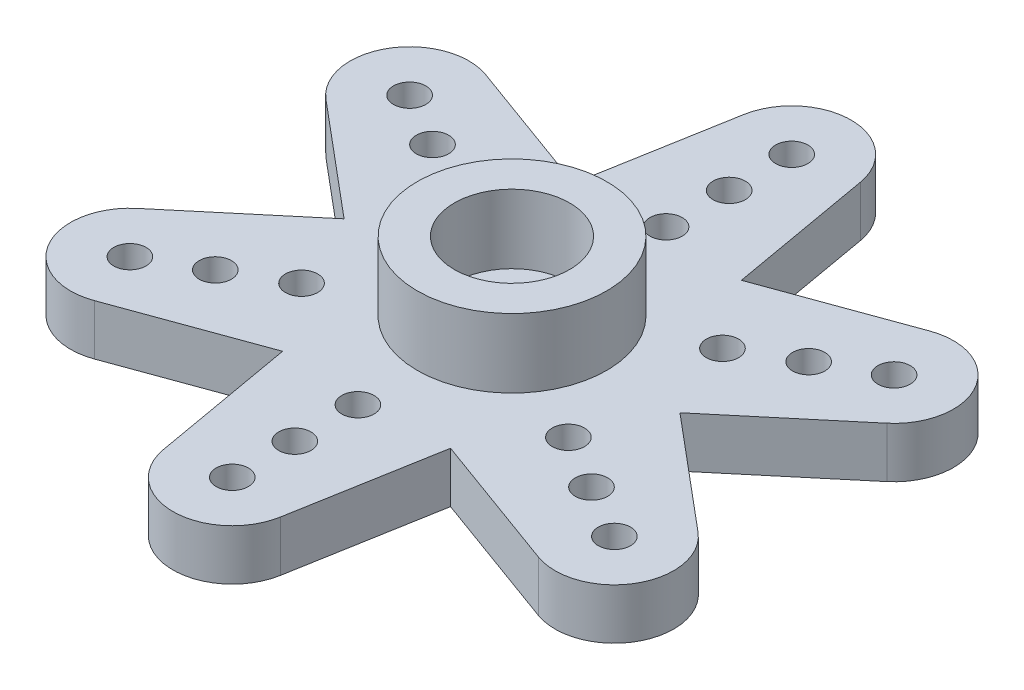
from build123d import *

# Parameters (mm, degrees)
SKETCH1_R           = 15.75
BOSS_EXTRUDE1_DEPTH = 2.35
CUT_EXTRUDE2_START  = -2.35
CUT_EXTRUDE2_DEPTH  = 2.35
SKETCH3_R           = 4.4
SKETCH3_R_2         = 2.68
BOSS_EXTRUDE2_DEPTH = 3.2
SKETCH4_R           = 1.5
CUT_EXTRUDE3_DEPTH  = 22.320518549


with BuildPart() as part:
    # Sketch1 → Boss-Extrude1 (new body)
    with BuildSketch(Plane(origin=(0, 0, 0), x_dir=(1, 0, 0), z_dir=(0, 1, 0))):
        with Locations(Location((0, 0, 0), (0, 0, 270))):
            Circle(SKETCH1_R)
    extrude(amount=BOSS_EXTRUDE1_DEPTH)

    # Sketch2 → Cut-Extrude2 (cut)
    with BuildSketch(Plane(origin=(0, 2.35, 0), x_dir=(1, 0, 0), z_dir=(0, 1, 0)).offset(CUT_EXTRUDE2_START)):
        with BuildLine():
            ThreePointArc((-11.901228971, -6.87117775), (-11.626709919, -5.846658698), (-10.602190866, -6.12117775))
            ThreePointArc((-10.602190866, -6.12117775), (-10.876709919, -7.145696803), (-11.901228971, -6.87117775))
        make_face()
        with BuildLine():
            ThreePointArc((-9.385628943, -5.418795397), (-9.11110989, -4.394276344), (-8.086590837, -4.668795397))
            ThreePointArc((-8.086590837, -4.668795397), (-8.36110989, -5.693314449), (-9.385628943, -5.418795397))
        make_face()
        with BuildLine():
            ThreePointArc((-6.846872878, -3.953043899), (-6.572353825, -2.928524846), (-5.547834772, -3.203043899))
            ThreePointArc((-5.547834772, -3.203043899), (-5.822353825, -4.227562952), (-6.846872878, -3.953043899))
        make_face()
        with BuildLine():
            ThreePointArc((-11.901228971, 6.87117775), (-10.876709919, 7.145696803), (-10.602190866, 6.12117775))
            ThreePointArc((-10.602190866, 6.12117775), (-11.626709919, 5.846658698), (-11.901228971, 6.87117775))
        make_face()
        with BuildLine():
            ThreePointArc((-9.385628943, 5.418795397), (-8.36110989, 5.693314449), (-8.086590837, 4.668795397))
            ThreePointArc((-8.086590837, 4.668795397), (-9.11110989, 4.394276344), (-9.385628943, 5.418795397))
        make_face()
        with BuildLine():
            ThreePointArc((-6.846872878, 3.953043899), (-5.822353825, 4.227562952), (-5.547834772, 3.203043899))
            ThreePointArc((-5.547834772, 3.203043899), (-6.572353825, 2.928524846), (-6.846872878, 3.953043899))
        make_face()
        with BuildLine():
            ThreePointArc((0, 13.742355501), (0.75, 12.992355501), (0, 12.242355501))
            ThreePointArc((0, 12.242355501), (-0.75, 12.992355501), (0, 13.742355501))
        make_face()
        with BuildLine():
            ThreePointArc((0, 7.906087798), (0.75, 7.156087798), (0, 6.406087798))
            ThreePointArc((0, 6.406087798), (-0.75, 7.156087798), (0, 7.906087798))
        make_face()
        with BuildLine():
            ThreePointArc((0, 10.837590793), (0.75, 10.087590793), (0, 9.337590793))
            ThreePointArc((0, 9.337590793), (-0.75, 10.087590793), (0, 10.837590793))
        make_face()
        with BuildLine():
            ThreePointArc((6.846872878, 3.953043899), (6.572353825, 2.928524846), (5.547834772, 3.203043899))
            ThreePointArc((5.547834772, 3.203043899), (5.822353825, 4.227562952), (6.846872878, 3.953043899))
        make_face()
        with BuildLine():
            ThreePointArc((9.385628943, 5.418795397), (9.11110989, 4.394276344), (8.086590837, 4.668795397))
            ThreePointArc((8.086590837, 4.668795397), (8.36110989, 5.693314449), (9.385628943, 5.418795397))
        make_face()
        with BuildLine():
            ThreePointArc((11.901228971, 6.87117775), (11.626709919, 5.846658698), (10.602190866, 6.12117775))
            ThreePointArc((10.602190866, 6.12117775), (10.876709919, 7.145696803), (11.901228971, 6.87117775))
        make_face()
        with BuildLine():
            ThreePointArc((6.846872878, -3.953043899), (5.822353825, -4.227562952), (5.547834772, -3.203043899))
            ThreePointArc((5.547834772, -3.203043899), (6.572353825, -2.928524846), (6.846872878, -3.953043899))
        make_face()
        with BuildLine():
            ThreePointArc((9.385628943, -5.418795397), (8.36110989, -5.693314449), (8.086590837, -4.668795397))
            ThreePointArc((8.086590837, -4.668795397), (9.11110989, -4.394276344), (9.385628943, -5.418795397))
        make_face()
        with BuildLine():
            ThreePointArc((11.901228971, -6.87117775), (10.876709919, -7.145696803), (10.602190866, -6.12117775))
            ThreePointArc((10.602190866, -6.12117775), (11.626709919, -5.846658698), (11.901228971, -6.87117775))
        make_face()
        with BuildLine():
            ThreePointArc((0, -7.906087798), (-0.75, -7.156087798), (0, -6.406087798))
            ThreePointArc((0, -6.406087798), (0.75, -7.156087798), (0, -7.906087798))
        make_face()
        with BuildLine():
            ThreePointArc((0, -10.837590793), (-0.75, -10.087590793), (0, -9.337590793))
            ThreePointArc((0, -9.337590793), (0.75, -10.087590793), (0, -10.837590793))
        make_face()
        with BuildLine():
            ThreePointArc((0, -13.742355501), (-0.75, -12.992355501), (0, -12.242355501))
            ThreePointArc((0, -12.242355501), (0.75, -12.992355501), (0, -13.742355501))
        make_face()
        with BuildLine():
            ThreePointArc((-10.308539952, -9.087515937), (-12.194879886, -9.087515937), (-13.63990011, -7.875))
            ThreePointArc((-13.63990011, -7.875), (-7.875, -13.63990011), (0, -15.75))
            ThreePointArc((0, -15.75), (-1.772579716, -15.104833745), (-2.715749683, -13.471215443))
            Line((-2.715749683, -13.471215443), (-3.9, -6.75499815))
            Line((-3.9, -6.75499815), (-10.308539952, -9.087515937))
        make_face()
        with BuildLine():
            ThreePointArc((-13.024289635, 4.383699506), (-13.967459602, 6.017317808), (-13.63990011, 7.875))
            ThreePointArc((-13.63990011, 7.875), (-15.75, 0), (-13.63990011, -7.875))
            ThreePointArc((-13.63990011, -7.875), (-13.967459602, -6.017317808), (-13.024289635, -4.383699506))
            Line((-13.024289635, -4.383699506), (-7.8, 0))
            Line((-7.8, 0), (-13.024289635, 4.383699506))
        make_face()
        with BuildLine():
            Line((-10.308539952, 9.087515937), (-3.9, 6.75499815))
            Line((-3.9, 6.75499815), (-2.715749683, 13.471215443))
            ThreePointArc((-2.715749683, 13.471215443), (-1.772579716, 15.104833745), (0, 15.75))
            ThreePointArc((0, 15.75), (-7.875, 13.63990011), (-13.63990011, 7.875))
            ThreePointArc((-13.63990011, 7.875), (-12.194879886, 9.087515937), (-10.308539952, 9.087515937))
        make_face()
        with BuildLine():
            ThreePointArc((13.63990011, 7.875), (7.875, 13.63990011), (0, 15.75))
            ThreePointArc((0, 15.75), (1.772579716, 15.104833745), (2.715749683, 13.471215443))
            Line((2.715749683, 13.471215443), (3.9, 6.75499815))
            Line((3.9, 6.75499815), (10.308539952, 9.087515937))
            ThreePointArc((10.308539952, 9.087515937), (12.194879886, 9.087515937), (13.63990011, 7.875))
        make_face()
        with BuildLine():
            ThreePointArc((15.75, 0), (15.213331764, 4.07639996), (13.63990011, 7.875))
            ThreePointArc((13.63990011, 7.875), (13.967459602, 6.017317808), (13.024289635, 4.383699506))
            Line((13.024289635, 4.383699506), (7.8, 0))
            Line((7.8, 0), (13.024289635, -4.383699506))
            ThreePointArc((13.024289635, -4.383699506), (13.967459602, -6.017317808), (13.63990011, -7.875))
            ThreePointArc((13.63990011, -7.875), (15.213331764, -4.07639996), (15.75, 0))
        make_face()
        with BuildLine():
            ThreePointArc((2.715749683, -13.471215443), (1.772579716, -15.104833745), (0, -15.75))
            ThreePointArc((0, -15.75), (7.875, -13.63990011), (13.63990011, -7.875))
            ThreePointArc((13.63990011, -7.875), (12.194879886, -9.087515937), (10.308539952, -9.087515937))
            Line((10.308539952, -9.087515937), (3.9, -6.75499815))
            Line((3.9, -6.75499815), (2.715749683, -13.471215443))
        make_face()
    extrude(amount=CUT_EXTRUDE2_DEPTH, mode=Mode.SUBTRACT)

    # Sketch3 → Boss-Extrude2 (add)
    with BuildSketch(Plane(origin=(0, 2.35, 0), x_dir=(1, 0, 0), z_dir=(0, 1, 0))):
        with Locations(Location((0, 0, 0), (0, 0, 270))):
            Circle(SKETCH3_R)
        with Locations(Location((0, 0, 0), (0, 0, 270))):
            Circle(SKETCH3_R_2, mode=Mode.SUBTRACT)
    extrude(amount=BOSS_EXTRUDE2_DEPTH)

    # Sketch4 → Cut-Extrude3 (cut, through all)
    with BuildSketch(Plane(origin=(0, 2.35, 0), x_dir=(1, 0, 0), z_dir=(0, 1, 0))):
        with Locations(Location((0, 0, 0), (0, 0, 270))):
            Circle(SKETCH4_R)
    extrude(amount=-CUT_EXTRUDE3_DEPTH, mode=Mode.SUBTRACT)


solid = part.part
